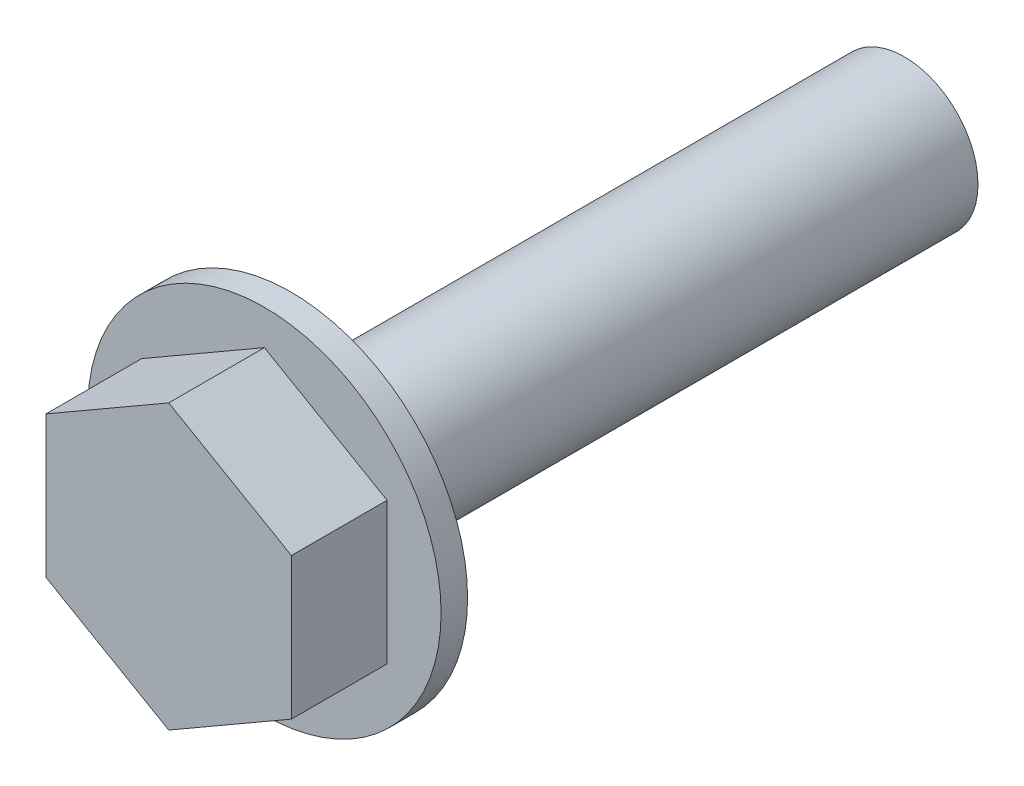
from build123d import *

# Parameters (mm, degrees)
EXTRUDE_SKETCH_1_R = 7.2
EXTRUDE_1_DEPTH    = 1.08
EXTRUDE_START      = 1.08
EXTRUDE_2_DEPTH    = 3.9
EXTRUDE_START_2    = -25
EXTRUDE_SKETCH_3_R = 3
EXTRUDE_3_DEPTH    = 25.01


with BuildPart() as part:
    # Extrude sketch 1 → Extrude 1 (new body)
    with BuildSketch(Plane.XY):
        Circle(EXTRUDE_SKETCH_1_R)
    extrude(amount=EXTRUDE_1_DEPTH)


with BuildPart() as body_2:
    # Extrude sketch 2 → Extrude 2 (new body)
    with BuildSketch(Plane.XY.offset(EXTRUDE_START)):
        Polygon((5, 2.886751346), (0, 5.773502692), (-5, 2.886751346), (-5, -2.886751346), (0, -5.773502692), (5, -2.886751346), align=None)
    extrude(amount=EXTRUDE_2_DEPTH)


with BuildPart() as body_3:
    # Extrude sketch 3 → Extrude 3 (new body)
    with BuildSketch(Plane.XY.offset(EXTRUDE_START_2)):
        Circle(EXTRUDE_SKETCH_3_R)
    extrude(amount=EXTRUDE_3_DEPTH)


with BuildPart() as body_2_1:
    add(body_2.part)

    # Combine (weld / assembly of features): union part, body 3
    add(part.part)
    add(body_3.part)


solid = body_2_1.part
